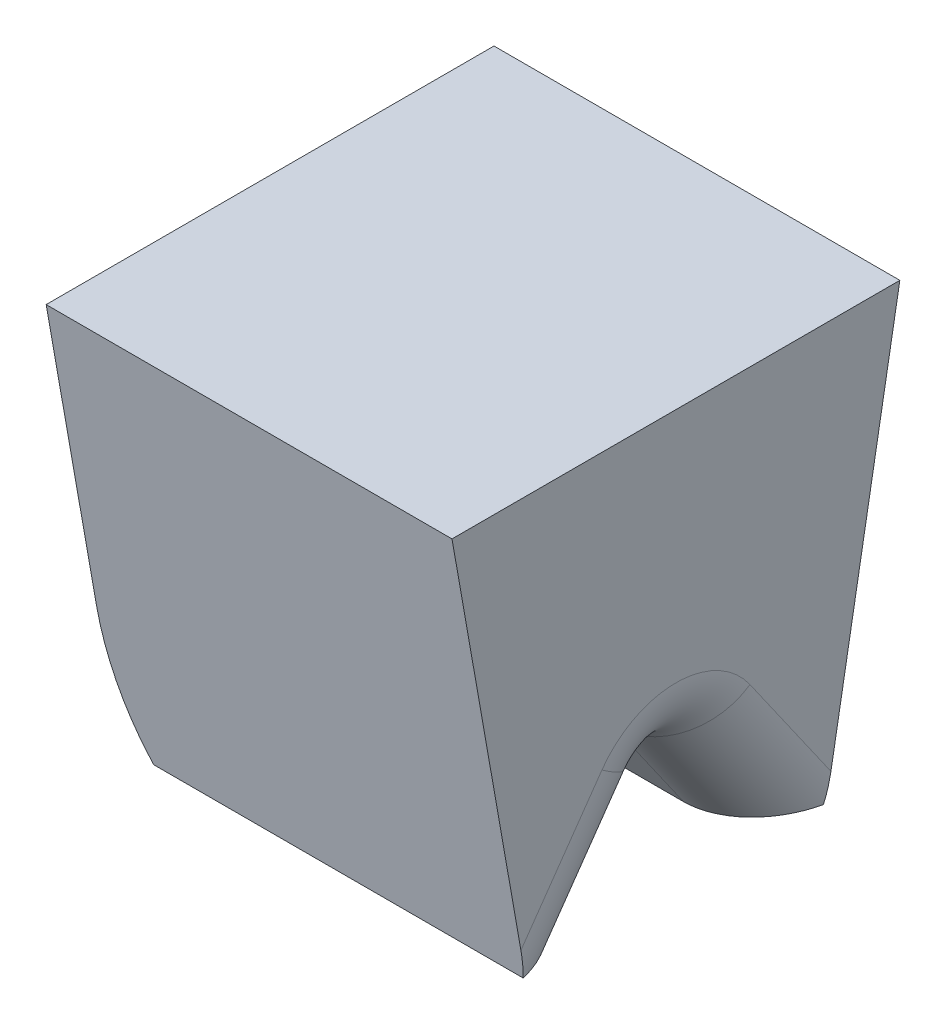
from build123d import *

# Parameters (mm, degrees)
SKETCH_TL_CUTTING_R    = 1.4986
TL_CUTTING_DEPTH       = 29.999999944
SKETCH_TDF_CUTTING_W   = 3.01719996
SKETCH_TDF_CUTTING_H   = 3.01719996
TDF_CUTTING_DEPTH      = 31.074766841
VW_VR_GRINDING_DEPTH   = 1.50859998
VW_VR_GRINDING_2_DEPTH = 1.50859998
ISA_GRINDING_DEPTH     = 1.50859998
SKETCH_PRE_FRX_BRX_W   = 1.08474002
SKETCH_PRE_FRX_BRX_H   = 1.09982
SKETCH_PRE_FRX_BRX_W_2 = 1.11219996
PRE_FRX_BRX_DEPTH      = 1.50859998
FA_BA_GRINDING_DEPTH   = 1.50859998
BR_EDM_R               = 0.29972
FR_EDM_R               = 0.14986


with BuildPart() as part:
    # sketch_TL_cutting → TL_cutting (new body)
    with BuildSketch(Plane(origin=(0, 0, 0), x_dir=(1, 0, 0), z_dir=(0, 1, 0))):
        with Locations(Location((0, 0, 0), (0, 0, 270))):
            Circle(SKETCH_TL_CUTTING_R)
    extrude(amount=TL_CUTTING_DEPTH)

    # sketch_TDF_cutting → TDF_cutting (cut, through all)
    with BuildSketch(Plane(origin=(0, 0, 0), x_dir=(1, 0, 0), z_dir=(0, 1, 0))):
        with Locations((-2.71001998, 0)):
            Rectangle(SKETCH_TDF_CUTTING_W, SKETCH_TDF_CUTTING_H)
    extrude(amount=TDF_CUTTING_DEPTH, mode=Mode.SUBTRACT)


with BuildPart() as body_2:
    # sketch_VW_VR_grinding → VW_VR_grinding (new, symmetric)
    with BuildSketch(Plane(origin=(0, 0, 0), x_dir=(0, 0, -1), z_dir=(1, 0, 0))):
        with BuildLine():
            Line((-1.49360001, -0.00999998), (-1.49360001, 1.088708914))
            ThreePointArc((-1.49360001, 1.088708914), (-1.493648337, 1.089815792), (-1.493792952, 1.090914246))
            Line((-1.493792952, 1.090914246), (-1.51859996, 1.231601782))
            Line((-1.51859996, 1.231601782), (-1.50859998, -0.00999998))
            Line((-1.50859998, -0.00999998), (-1.49360001, -0.00999998))
        make_face()
    extrude(amount=VW_VR_GRINDING_DEPTH, both=True)


with BuildPart() as body_3:
    # sketch_VW_VR_grinding → VW_VR_grinding 2 (new, symmetric)
    with BuildSketch(Plane(origin=(0, 0, 0), x_dir=(0, 0, -1), z_dir=(1, 0, 0))):
        with BuildLine():
            Line((1.49360001, -0.00999998), (1.49360001, 1.088708914))
            ThreePointArc((1.49360001, 1.088708914), (1.493648337, 1.089815792), (1.493792952, 1.090914246))
            Line((1.493792952, 1.090914246), (1.51859996, 1.231601782))
            Line((1.51859996, 1.231601782), (1.50859998, -0.00999998))
            Line((1.50859998, -0.00999998), (1.49360001, -0.00999998))
        make_face()
    extrude(amount=VW_VR_GRINDING_2_DEPTH, both=True)


    add(body_2.part)  # ISA_grinding merges body 2
    # sketch_ISA_grinding → ISA_grinding (add, symmetric)
    with BuildSketch(Plane(origin=(0, 0, 0), x_dir=(0, 0, -1), z_dir=(1, 0, 0))):
        Polygon((-0.29972, 0), (0.29972, 0), (1.50859998, 6.855899053), (1.50859998, -0.02999994), (-1.50859998, -0.02999994), (-1.50859998, 6.855899053), align=None)
    extrude(amount=ISA_GRINDING_DEPTH, both=True)

    # sketch_pre_FRX_BRX → pre_FRX_BRX (add, symmetric)
    with BuildSketch(Plane.XY):
        with Locations((0.95622999, 0.53991002)):
            Rectangle(SKETCH_PRE_FRX_BRX_W, SKETCH_PRE_FRX_BRX_H)
        with Locations((-0.96249998, 0.53991002)):
            Rectangle(SKETCH_PRE_FRX_BRX_W_2, SKETCH_PRE_FRX_BRX_H)
    extrude(amount=PRE_FRX_BRX_DEPTH, both=True)

    # sketch_FA_BA_grinding → FA_BA_grinding (add, symmetric)
    with BuildSketch(Plane.XY):
        Polygon((0.40386, -0.00999998), (0.40386, 1.09982), (1.6256, 9.792951805), (1.6256, -0.00999998), align=None)
        Polygon((-0.4064, -0.00999998), (-0.4064, 1.09982), (-1.32842, 7.660333191), (-1.32842, -0.00999998), align=None)
    extrude(amount=FA_BA_GRINDING_DEPTH, both=True)


with BuildPart() as part_1:
    add(part.part)

    # B1_fix: cut body 3
    add(body_3.part, mode=Mode.SUBTRACT)

    # V-Groove_EDM: sweep along a path in sketch_contour_V-Groove
    with BuildLine(Plane.XY) as v_groove_edm_path:
        Line((-1.20142, 0.21336), (1.4986, 0.21336))
    # sketch_section_V-Groove → V-Groove_EDM (sweep, cut)
    with BuildSketch(Plane(origin=(-1.20142, 0, -1.2954), x_dir=(0, 0, -1), z_dir=(1, 0, 0))):
        with BuildLine():
            Line((-1.270432246, 0.20036261), (-1.123134775, -0.00999998))
            Line((-1.123134775, -0.00999998), (-1.467665225, -0.00999998))
            Line((-1.467665225, -0.00999998), (-1.320367754, 0.20036261))
            ThreePointArc((-1.320367754, 0.20036261), (-1.2954, 0.21336), (-1.270432246, 0.20036261))
        make_face()
    sweep(path=v_groove_edm_path.line, mode=Mode.SUBTRACT)

    # BR_EDM
    br_edm_edges = [part_1.edges().sort_by_distance(p)[0] for p in [
        (-0.4064, 0.21336, 0),
        (-0.4064, 0.100181305, -0.095115459),
        (-0.4064, 0.100181305, 0.095115459),
    ]]
    fillet(br_edm_edges, radius=BR_EDM_R)

    # FR_EDM
    fr_edm_edges = [part_1.edges().sort_by_distance(p)[0] for p in [
        (0.40386, 0.100181305, -0.095115459),
        (0.40386, 0.100181305, 0.095115459),
        (0.40386, 0.21336, 0),
    ]]
    fillet(fr_edm_edges, radius=FR_EDM_R)

    # SurfaceCut1
    split(bisect_by=Plane(origin=(0, 0.835526316, 0), x_dir=(1, 0, 0), z_dir=(0, 1, 0)), keep=Keep.BOTTOM)


solid = part_1.part
